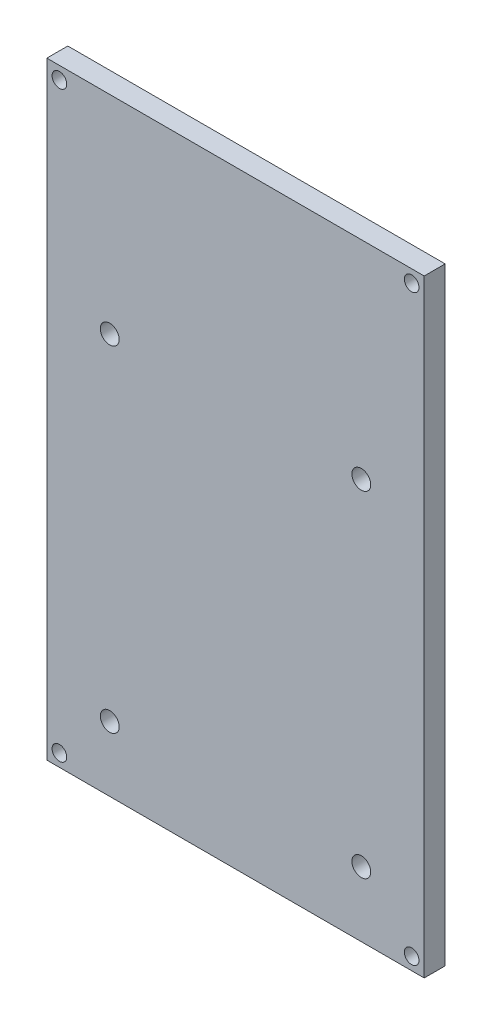
from build123d import *

# Parameters (mm, degrees)
SKETCH1_W           = 90
SKETCH1_H           = 145
BOSS_EXTRUDE1_DEPTH = 5
SKETCH2_R           = 1.75
CUT_EXTRUDE1_DEPTH  = 86.476604986
SKETCH3_R           = 2.25
CUT_EXTRUDE2_DEPTH  = 86.476604986


with BuildPart() as part:
    # Sketch1 → Boss-Extrude1 (new body)
    with BuildSketch(Plane.XY):
        Rectangle(SKETCH1_W, SKETCH1_H)
    extrude(amount=BOSS_EXTRUDE1_DEPTH)

    # Sketch2 → Cut-Extrude1 (cut, through all)
    with BuildSketch(Plane(origin=(0, 0, 0), x_dir=(-1, 0, 0), z_dir=(0, 0, -1))):
        with Locations((-42, 69.5)):
            Circle(SKETCH2_R)
        with Locations(Location((-42, -69.5, 0), (0, 0, 180))):
            Circle(SKETCH2_R)
        with Locations(Location((42, 69.5, 0), (0, 0, 180))):
            Circle(SKETCH2_R)
        with Locations((42, -69.5)):
            Circle(SKETCH2_R)
    extrude(amount=-CUT_EXTRUDE1_DEPTH, mode=Mode.SUBTRACT)

    # Sketch3 → Cut-Extrude2 (cut, through all)
    with BuildSketch(Plane(origin=(0, 0, 0), x_dir=(-1, 0, 0), z_dir=(0, 0, -1))):
        with Locations((-30, 23)):
            Circle(SKETCH3_R)
        with Locations(Location((30, 23, 0), (0, 0, 180))):
            Circle(SKETCH3_R)
        with Locations((30, -57)):
            Circle(SKETCH3_R)
        with Locations(Location((-30, -57, 0), (0, 0, 180))):
            Circle(SKETCH3_R)
    extrude(amount=-CUT_EXTRUDE2_DEPTH, mode=Mode.SUBTRACT)


solid = part.part
